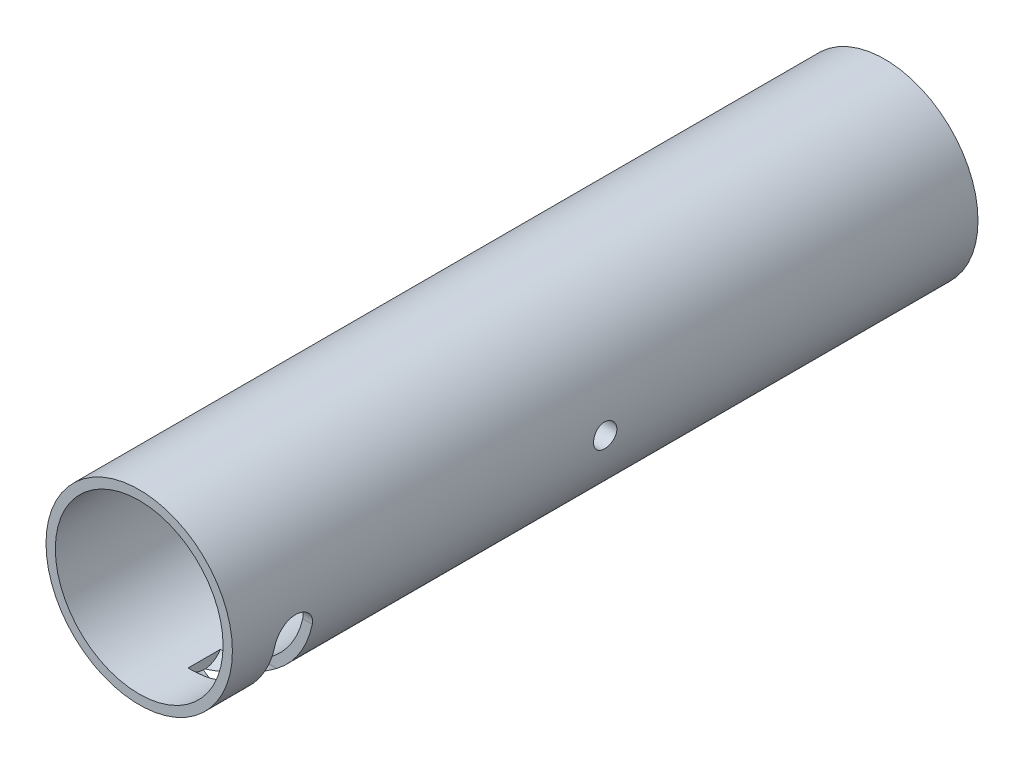
from build123d import *

# Parameters (mm, degrees)
ESQUISSE2_R                   = 50
BOSS_EXTRU_1_DEPTH            = 200
ENL_V_MAT_EXTRU_1_DEPTH       = 213.132034356
ENL_V_MAT_EXTRU_1_DEPTH_BACK  = 213.132034356
ESQUISSE3_R                   = 6.25
ENL_V_START                   = -100
ESQUISSE4_R                   = 45
ENL_V_MAT_EXTRU_2_DEPTH       = 507.201920355
ENL_V_MAT_EXTRU_11_DEPTH      = 230.128784901
ENL_V_MAT_EXTRU_11_DEPTH_BACK = 49


with BuildPart() as part:
    # Esquisse2 → Boss.-Extru.1 (new, symmetric)
    with BuildSketch(Plane.XY):
        Circle(ESQUISSE2_R)
    extrude(amount=BOSS_EXTRU_1_DEPTH, both=True)

    # Esquisse3 → Enlèv. mat.-Extru.1 (cut, two sides: drawn at the far end of the back side and taken through both)
    with BuildSketch(Plane(origin=(0, 0, 0), x_dir=(0, 0, -1), z_dir=(1, 0, 0)).offset(-ENL_V_MAT_EXTRU_1_DEPTH_BACK)):
        Circle(ESQUISSE3_R)
    extrude(amount=ENL_V_MAT_EXTRU_1_DEPTH + ENL_V_MAT_EXTRU_1_DEPTH_BACK, mode=Mode.SUBTRACT)

    # Esquisse4 → Enlèv. mat.-Extru.2 (cut)
    with BuildSketch(Plane.XY.offset(200).offset(ENL_V_START)):
        with Locations(Location((0, 0, 0), (0, 0, 180))):
            Circle(ESQUISSE4_R)
    enl_v_mat_extru_2 = extrude(amount=ENL_V_MAT_EXTRU_2_DEPTH, mode=Mode.SUBTRACT)

    # Symétrie1: Enlèv. mat.-Extru.2 across plane
    add(enl_v_mat_extru_2.mirror(Plane.XY), mode=Mode.SUBTRACT)

    # Esquisse5 → Enlèv. mat.-Extru.11 (cut, two sides: drawn at the far end of the back side and taken through both)
    with BuildSketch(Plane(origin=(50, 0, 0), x_dir=(0, 0, -1), z_dir=(1, 0, 0)).offset(-ENL_V_MAT_EXTRU_11_DEPTH_BACK)):
        with BuildLine():
            Line((-156.140277695, -10), (-156.140277695, -40))
            ThreePointArc((-156.140277695, -40), (-166.140277695, -50), (-176.140277695, -40))
            Line((-176.140277695, -40), (-176.140277695, -10))
            ThreePointArc((-176.140277695, -10), (-166.140277695, 0), (-156.140277695, -10))
        make_face()
    extrude(amount=ENL_V_MAT_EXTRU_11_DEPTH + ENL_V_MAT_EXTRU_11_DEPTH_BACK, mode=Mode.SUBTRACT)


solid = part.part
